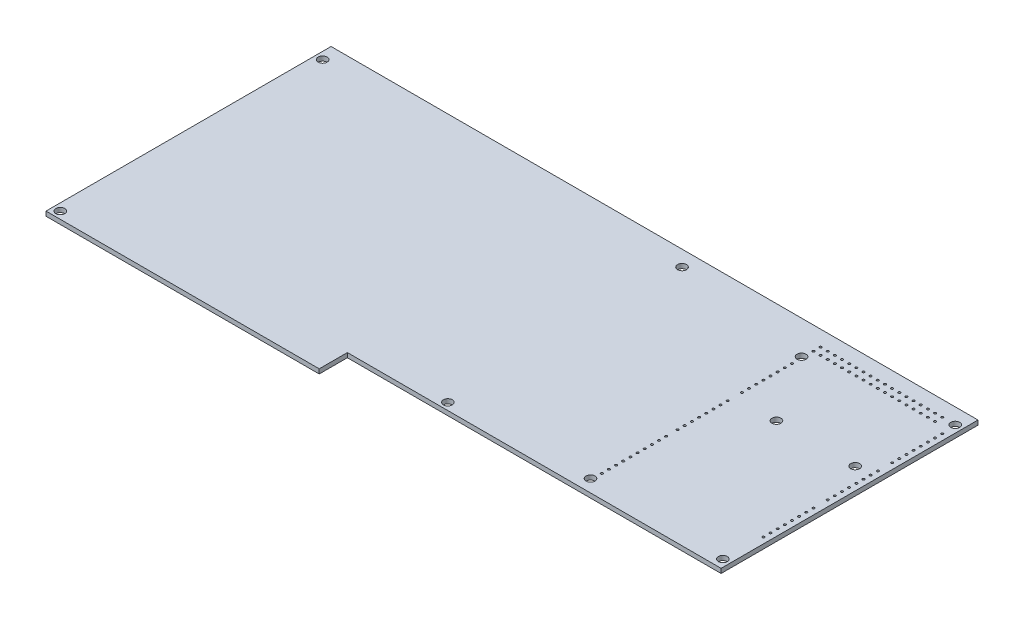
from build123d import *

# Parameters (mm, degrees)
SKETCH1_R           = 1.5875
BOSS_EXTRUDE1_DEPTH = 1.6
SKETCH2_R           = 0.4
CUT_EXTRUDE1_DEPTH  = 1.65
SKETCH3_R           = 0.4
CUT_EXTRUDE2_DEPTH  = 1.65
LPATTERN1_COUNT     = 26
LPATTERN1_PITCH     = 2.54
SKETCH4_R           = 0.4
CUT_EXTRUDE3_DEPTH  = 1.65
LPATTERN2_COUNT     = 10
LPATTERN2_PITCH     = 2.54
LPATTERN3_COUNT     = 17
LPATTERN3_PITCH     = 2.54
SKETCH7_R           = 0.4
CUT_EXTRUDE6_DEPTH  = 10
LPATTERN4_COUNT     = 18
LPATTERN4_PITCH     = 2.54


with BuildPart() as part:
    # Sketch1 → Boss-Extrude1 (new body)
    with BuildSketch(Plane(origin=(0, 0, 0), x_dir=(1, 0, 0), z_dir=(0, 1, 0))):
        Polygon((-0.433542031, 10.808375706), (-133.173282181, 10.808375706), (-133.173282181, 0.808375706), (-230.216047893, 0.808375706), (-230.216047893, 102.06), (-0.433542031, 102.06), align=None)
        with Locations(Location((-8.053542031, 66.04, 0), (0, 0, 270))):
            Circle(SKETCH1_R, mode=Mode.SUBTRACT)
        with Locations(Location((-35.993542031, 66.04, 0), (0, 0, 270))):
            Circle(SKETCH1_R, mode=Mode.SUBTRACT)
        with Locations(Location((-2.973542031, 13.97, 0), (0, 0, 270))):
            Circle(SKETCH1_R, mode=Mode.SUBTRACT)
        with Locations(Location((-51.233542031, 15.24, 0), (0, 0, 270))):
            Circle(SKETCH1_R, mode=Mode.SUBTRACT)
        with Locations(Location((-2.973542031, 96.52, 0), (0, 0, 270))):
            Circle(SKETCH1_R, mode=Mode.SUBTRACT)
        with Locations(Location((-51.233542031, 90.17, 0), (0, 0, 270))):
            Circle(SKETCH1_R, mode=Mode.SUBTRACT)
        with Locations(Location((-227.676047893, 3.348375706, 0), (0, 0, 270))):
            Circle(SKETCH1_R, mode=Mode.SUBTRACT)
        with Locations(Location((-227.676047893, 96.52, 0), (0, 0, 270))):
            Circle(SKETCH1_R, mode=Mode.SUBTRACT)
        with Locations(Location((-100.01059482, 96.52, 0), (0, 0, 270))):
            Circle(SKETCH1_R, mode=Mode.SUBTRACT)
        with Locations(Location((-100.01059482, 13.348375706, 0), (0, 0, 270))):
            Circle(SKETCH1_R, mode=Mode.SUBTRACT)
    extrude(amount=-BOSS_EXTRUDE1_DEPTH)

    # Sketch2 → Cut-Extrude1 (cut)
    with BuildSketch(Plane(origin=(0, 0, 0), x_dir=(1, 0, 0), z_dir=(0, 1, 0))):
        with Locations(Location((-2.54, 27.94, 0), (0, 0, 270))):
            Circle(SKETCH2_R)
    cut_extrude1 = extrude(amount=-CUT_EXTRUDE1_DEPTH, mode=Mode.SUBTRACT)

    # Sketch3 → Cut-Extrude2 (cut)
    with BuildSketch(Plane(origin=(0, 0, 0), x_dir=(1, 0, 0), z_dir=(0, 1, 0))):
        with Locations(Location((-50.8, 18.796, 0), (0, 0, 270))):
            Circle(SKETCH3_R)
    cut_extrude2 = extrude(amount=-CUT_EXTRUDE2_DEPTH, mode=Mode.SUBTRACT)

    # LPattern1: Cut-Extrude1 ×26, 2 skipped
    with Locations(*[(0, 0, -i * LPATTERN1_PITCH) for i in range(1, LPATTERN1_COUNT) if i not in (8, 17)]):
        add(cut_extrude1, mode=Mode.SUBTRACT)

    # Sketch4 → Cut-Extrude3 (cut)
    with BuildSketch(Plane(origin=(0, 0, 0), x_dir=(1, 0, 0), z_dir=(0, 1, 0))):
        with Locations(Location((-50.8, 45.72, 0), (0, 0, 270))):
            Circle(SKETCH4_R)
    cut_extrude3 = extrude(amount=-CUT_EXTRUDE3_DEPTH, mode=Mode.SUBTRACT)

    # LPattern2: Cut-Extrude2 ×10
    with Locations(*[(0, 0, -i * LPATTERN2_PITCH) for i in range(1, LPATTERN2_COUNT)]):
        add(cut_extrude2, mode=Mode.SUBTRACT)

    # LPattern3: Cut-Extrude3 ×17, 1 skipped
    with Locations(*[(0, 0, -i * LPATTERN3_PITCH) for i in range(1, LPATTERN3_COUNT) if i not in (8,)]):
        add(cut_extrude3, mode=Mode.SUBTRACT)

    # Sketch7 → Cut-Extrude6 (cut)
    with BuildSketch(Plane(origin=(0, 0, 0), x_dir=(1, 0, 0), z_dir=(0, 1, 0))):
        with Locations(Location((-50.8, 96.52, 0), (0, 0, 270))):
            Circle(SKETCH7_R)
        with Locations(Location((-50.8, 93.98, 0), (0, 0, 270))):
            Circle(SKETCH7_R)
    cut_extrude6 = extrude(amount=-CUT_EXTRUDE6_DEPTH, mode=Mode.SUBTRACT)

    # LPattern4: Cut-Extrude6 ×18
    with Locations(*[(i * LPATTERN4_PITCH, 0, 0) for i in range(1, LPATTERN4_COUNT)]):
        add(cut_extrude6, mode=Mode.SUBTRACT)


solid = part.part
